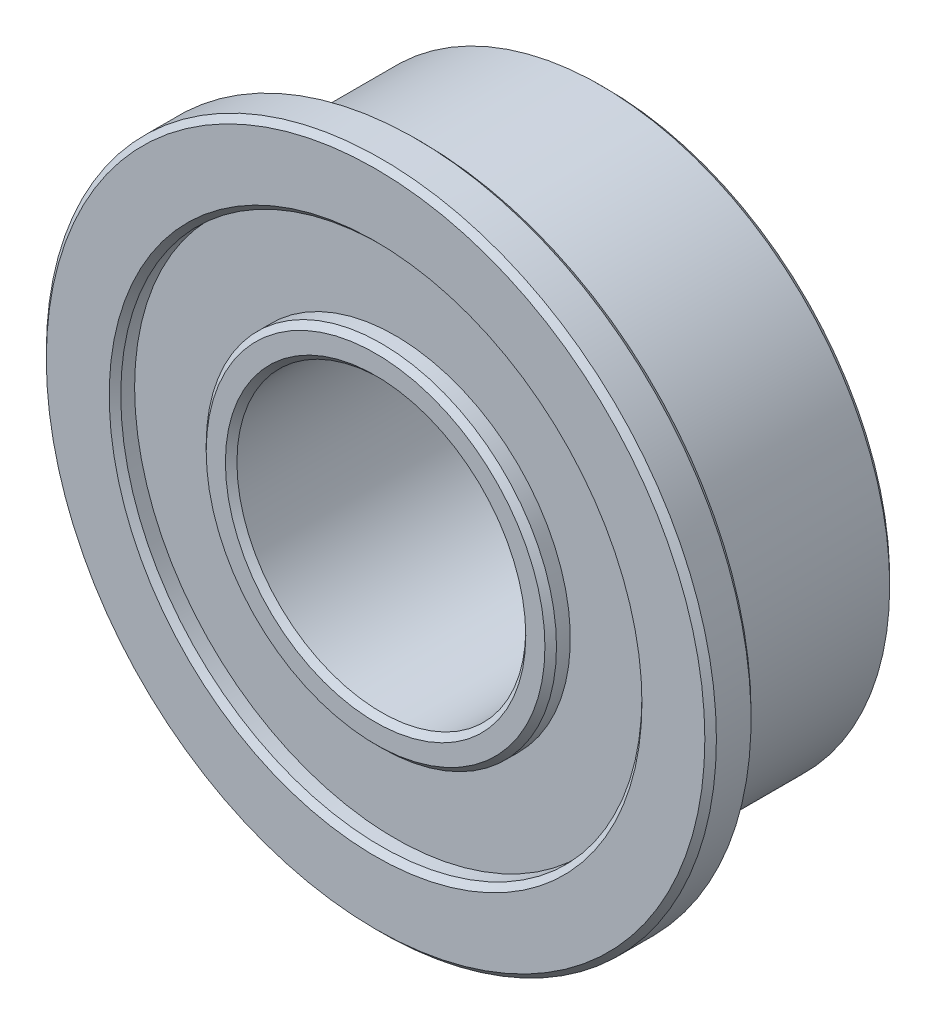
from build123d import *

# Parameters (mm, degrees)
CHAMFER1_SIZE = 0.1


with BuildPart() as part:
    # Sketch1 → Revolve1 (revolve)
    with BuildSketch(Plane(origin=(0, 0, 0), x_dir=(0, 0, -1), z_dir=(1, 0, 0)), mode=Mode.PRIVATE) as revolve1_sk:
        Polygon((-1.2, 5), (2, 5), (2, 4.510995713), (1.660325371, 4.510995713), (1.660325371, 3.031838511), (2, 3.031838511), (2, 2.5), (-2, 2.5), (-2, 3.031838511), (-1.660325371, 3.031838511), (-1.660325371, 4.510995713), (-2, 4.510995713), (-2, 5.8), (-1.2, 5.8), align=None)
    revolve(revolve1_sk.sketch.rotate(Axis((0, 0, -19.078271996), (0, 0, 1)), 90), axis=Axis((0, 0, -19.078271996), (0, 0, 1)))

    # Chamfer1
    chamfer1_edges = [part.edges().sort_by_distance(p)[0] for p in [
        (3.031838511, 0, 2),
        (4.510995713, 0, 2),
        (5.8, 0, 2),
        (5.8, 0, 1.2),
        (5, 0, -2),
        (4.510995713, 0, -2),
        (3.031838511, 0, -2),
        (2.5, 0, -2),
        (2.5, 0, 2),
    ]]
    chamfer(chamfer1_edges, length=CHAMFER1_SIZE)


solid = part.part
